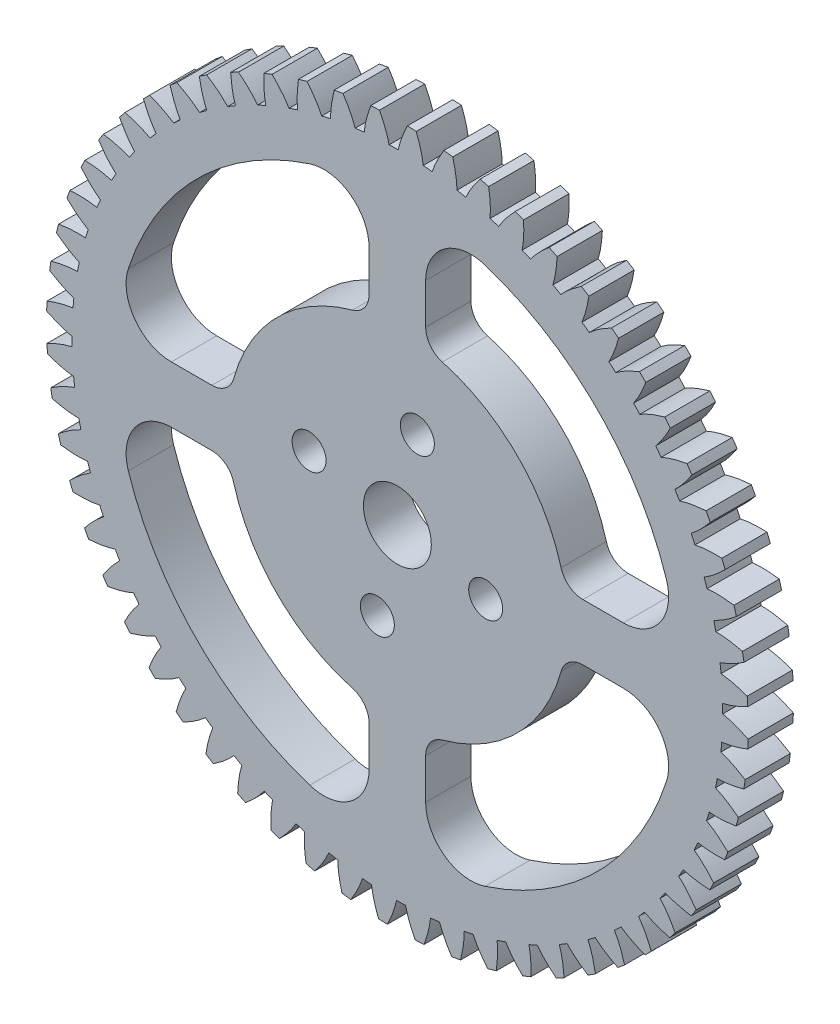
from build123d import *

# Parameters (mm, degrees)
EXTRUDE_1_DEPTH     = 4
SKETCH_7_R          = 3
CUT_EXTRUDE_1_DEPTH = 45.005100553
SKETCH_8_R          = 1.5
CUT_EXTRUDE_2_DEPTH = 45.005100553
CUT_EXTRUDE_3_DEPTH = 45.005100553
FILLET_1_R          = 4
FILLET_2_R          = 2


with BuildPart() as part:
    # 草图6 → 凸台-拉伸1 (new body)
    with BuildSketch(Plane.XY):
        with BuildLine():
            ThreePointArc((3.07982651, 28.584561719), (2.682610889, 28.624571592), (2.284877997, 28.659061962))
            add(Edge.make_bspline(
                [(2.284877997, 28.659061962), (2.278167168, 28.715603398), (2.245299574, 28.963818331), (2.156727862, 29.439082851), (2.003028036, 30.015823083), (1.830054345, 30.526803196), (1.707093128, 30.849984997), (1.665638862, 30.955220031)],
                knots=[0.033215675, 0.033215675, 0.033215675, 0.033215675, 0.033215675, 0.046610139, 0.092110525, 0.146842495, 0.173450652, 0.173450652, 0.173450652, 0.173450652, 0.173450652], degree=4))
            ThreePointArc((1.665638862, 30.955220031), (1.273253712, 30.973840979), (0.880664109, 30.987488293))
            add(Edge.make_bspline(
                [(0.075054588, 28.749902031), (0.086383474, 28.805701901), (0.139512684, 29.05038173), (0.266793411, 29.51677312), (0.467311243, 30.078952389), (0.681640578, 30.574011487), (0.830712428, 30.886010719), (0.880664109, 30.987488293)],
                knots=[0.033215675, 0.033215675, 0.033215675, 0.033215675, 0.033215675, 0.046610139, 0.092110525, 0.146842495, 0.173450652, 0.173450652, 0.173450652, 0.173450652, 0.173450652], degree=4))
            ThreePointArc((0.075054588, 28.749902031), (-0.324167214, 28.748172387), (-0.72332651, 28.740899408))
            add(Edge.make_bspline(
                [(-0.72332651, 28.740899408), (-0.735910765, 28.796429631), (-0.794543833, 29.039849218), (-0.93230901, 29.503251924), (-1.145452622, 30.060766706), (-1.370890711, 30.550866943), (-1.52696003, 30.859425373), (-1.579187262, 30.959750768)],
                knots=[0.033215675, 0.033215675, 0.033215675, 0.033215675, 0.033215675, 0.046610139, 0.092110525, 0.146842495, 0.173450652, 0.173450652, 0.173450652, 0.173450652, 0.173450652], degree=4))
            ThreePointArc((-1.579187262, 30.959750768), (-1.971369304, 30.937254291), (-2.363234793, 30.909790056))
            add(Edge.make_bspline(
                [(-2.930539647, 28.600252401), (-2.925105497, 28.656930784), (-2.89784334, 28.905823746), (-2.820011046, 29.382964654), (-2.679355407, 29.963024067), (-2.517947957, 30.477774695), (-2.402305539, 30.803647014), (-2.363234793, 30.909790056)],
                knots=[0.033215675, 0.033215675, 0.033215675, 0.033215675, 0.033215675, 0.046610139, 0.092110525, 0.146842495, 0.173450652, 0.173450652, 0.173450652, 0.173450652, 0.173450652], degree=4))
            ThreePointArc((-2.930539647, 28.600252401), (-3.327393674, 28.55680219), (-3.723606099, 28.507845545))
            add(Edge.make_bspline(
                [(-3.723606099, 28.507845545), (-3.741925905, 28.561756155), (-3.825682051, 28.797713439), (-4.011131308, 29.244177195), (-4.281383461, 29.776358278), (-4.556816001, 30.240208998), (-4.744283495, 30.530763426), (-4.80671148, 30.625079996)],
                knots=[0.033215675, 0.033215675, 0.033215675, 0.033215675, 0.033215675, 0.046610139, 0.092110525, 0.146842495, 0.173450652, 0.173450652, 0.173450652, 0.173450652, 0.173450652], degree=4))
            ThreePointArc((-4.80671148, 30.625079996), (-5.194393585, 30.561712571), (-5.5812416, 30.493437691))
            add(Edge.make_bspline(
                [(-5.904026277, 28.13725242), (-5.9045464, 28.194188336), (-5.903449987, 28.444567508), (-5.875918872, 28.927230278), (-5.796666478, 29.518814583), (-5.689949328, 30.047617026), (-5.609003343, 30.383792107), (-5.5812416, 30.493437691)],
                knots=[0.033215675, 0.033215675, 0.033215675, 0.033215675, 0.033215675, 0.046610139, 0.092110525, 0.146842495, 0.173450652, 0.173450652, 0.173450652, 0.173450652, 0.173450652], degree=4))
            ThreePointArc((-5.904026277, 28.13725242), (-6.294164512, 28.052557693), (-6.683089082, 27.962453761))
            add(Edge.make_bspline(
                [(-6.683089082, 27.962453761), (-6.706943723, 28.014154102), (-6.814905295, 28.240063886), (-7.046006813, 28.664697141), (-7.370406567, 29.165713838), (-7.692815862, 29.598232995), (-7.909627597, 29.867600047), (-7.981572361, 29.954874439)],
                knots=[0.033215675, 0.033215675, 0.033215675, 0.033215675, 0.033215675, 0.046610139, 0.092110525, 0.146842495, 0.173450652, 0.173450652, 0.173450652, 0.173450652, 0.173450652], degree=4))
            ThreePointArc((-7.981572361, 29.954874439), (-8.360507004, 29.851330333), (-8.738099156, 29.742992841))
            add(Edge.make_bspline(
                [(-8.812827159, 27.365974813), (-8.819295857, 27.422544461), (-8.8443772, 27.671666636), (-8.867448901, 28.154563114), (-8.850468059, 28.751190789), (-8.799610422, 29.288251376), (-8.754247733, 29.631046014), (-8.738099156, 29.742992841)],
                knots=[0.033215675, 0.033215675, 0.033215675, 0.033215675, 0.033215675, 0.046610139, 0.092110525, 0.146842495, 0.173450652, 0.173450652, 0.173450652, 0.173450652, 0.173450652], degree=4))
            ThreePointArc((-8.812827159, 27.365974813), (-9.191975167, 27.240963502), (-9.569350741, 27.110699482))
            add(Edge.make_bspline(
                [(-9.569350741, 27.110699482), (-9.598478861, 27.159623114), (-9.729463012, 27.373010284), (-10.003684793, 27.771160666), (-10.378677956, 28.235523734), (-10.744531622, 28.631972557), (-10.988312164, 28.877200991), (-11.068985465, 28.956477009)],
                knots=[0.033215675, 0.033215675, 0.033215675, 0.033215675, 0.033215675, 0.046610139, 0.092110525, 0.146842495, 0.173450652, 0.173450652, 0.173450652, 0.173450652, 0.173450652], degree=4))
            ThreePointArc((-11.068985465, 28.956477009), (-11.435020958, 28.813890673), (-11.799220269, 28.666677538))
            add(Edge.make_bspline(
                [(-11.625072863, 26.29486986), (-11.637419263, 26.35045345), (-11.688403566, 26.595589193), (-11.761825304, 27.073428665), (-11.807302059, 27.668562932), (-11.812861144, 28.207997516), (-11.803578753, 28.553655981), (-11.799220269, 28.666677538)],
                knots=[0.033215675, 0.033215675, 0.033215675, 0.033215675, 0.033215675, 0.046610139, 0.092110525, 0.146842495, 0.173450652, 0.173450652, 0.173450652, 0.173450652, 0.173450652], degree=4))
            ThreePointArc((-11.625072863, 26.29486986), (-11.989076618, 26.130911616), (-12.350768591, 25.961914706))
            add(Edge.make_bspline(
                [(-12.350768591, 25.961914706), (-12.384851057, 26.007525612), (-12.537422695, 26.206052252), (-12.851760308, 26.573357544), (-13.273238378, 26.995979323), (-13.678528045, 27.352014237), (-13.946606483, 27.570417278), (-14.035124448, 27.640826358)],
                knots=[0.033215675, 0.033215675, 0.033215675, 0.033215675, 0.033215675, 0.046610139, 0.092110525, 0.146842495, 0.173450652, 0.173450652, 0.173450652, 0.173450652, 0.173450652], degree=4))
            ThreePointArc((-14.035124448, 27.640826358), (-14.384250429, 27.460759997), (-14.731066656, 27.276284116))
            add(Edge.make_bspline(
                [(-14.309951836, 24.935672809), (-14.328040668, 24.989661357), (-14.404369336, 25.22812491), (-14.527336688, 25.695672065), (-14.634772787, 26.28279251), (-14.696687687, 26.818690932), (-14.723587294, 27.163426118), (-14.731066656, 27.276284116)],
                knots=[0.033215675, 0.033215675, 0.033215675, 0.033215675, 0.033215675, 0.046610139, 0.092110525, 0.146842495, 0.173450652, 0.173450652, 0.173450652, 0.173450652, 0.173450652], degree=4))
            ThreePointArc((-14.309951836, 24.935672809), (-14.654823236, 24.734563993), (-14.996868836, 24.52868576))
            add(Edge.make_bspline(
                [(-14.996868836, 24.52868576), (-15.035532233, 24.570484216), (-15.208019752, 24.751975228), (-15.559029249, 25.084411156), (-16.022374422, 25.460661314), (-16.462659653, 25.772381524), (-16.752098863, 25.961566304), (-16.84749167, 26.022337029)],
                knots=[0.033215675, 0.033215675, 0.033215675, 0.033215675, 0.033215675, 0.046610139, 0.092110525, 0.146842495, 0.173450652, 0.173450652, 0.173450652, 0.173450652, 0.173450652], degree=4))
            ThreePointArc((-16.84749167, 26.022337029), (-17.175883043, 25.806763487), (-17.501516394, 25.587046018))
            add(Edge.make_bspline(
                [(-16.838047982, 23.30327531), (-16.861681061, 23.355077305), (-16.962517822, 23.584256011), (-17.133683531, 24.036388306), (-17.301901882, 24.609062313), (-17.419494244, 25.135553158), (-17.482281131, 25.475588074), (-17.501516394, 25.587046018)],
                knots=[0.033215675, 0.033215675, 0.033215675, 0.033215675, 0.033215675, 0.046610139, 0.092110525, 0.146842495, 0.173450652, 0.173450652, 0.173450652, 0.173450652, 0.173450652], degree=4))
            ThreePointArc((-16.838047982, 23.30327531), (-17.160008545, 23.067219311), (-17.478660248, 22.826715399))
            add(Edge.make_bspline(
                [(-17.478660248, 22.826715399), (-17.521480971, 22.864243454), (-17.711994562, 23.026710384), (-18.095830208, 23.320634709), (-18.59596598, 23.646390971), (-19.066422916, 23.910381207), (-19.374051743, 24.068274977), (-19.475274248, 24.118741529)],
                knots=[0.033215675, 0.033215675, 0.033215675, 0.033215675, 0.033215675, 0.046610139, 0.092110525, 0.146842495, 0.173450652, 0.173450652, 0.173450652, 0.173450652, 0.173450652], degree=4))
            ThreePointArc((-19.475274248, 24.118741529), (-19.779333088, 23.870022677), (-20.080215856, 23.617470889))
            add(Edge.make_bspline(
                [(-19.18166295, 21.41556225), (-19.210581348, 21.464610138), (-19.334821413, 21.681993068), (-19.552310152, 22.113756846), (-19.779467719, 22.665710079), (-19.951449177, 23.177025004), (-20.049435438, 23.508634156), (-20.080215856, 23.617470889)],
                knots=[0.033215675, 0.033215675, 0.033215675, 0.033215675, 0.033215675, 0.046610139, 0.092110525, 0.146842495, 0.173450652, 0.173450652, 0.173450652, 0.173450652, 0.173450652], degree=4))
            ThreePointArc((-19.18166295, 21.41556225), (-19.477185209, 21.147145347), (-19.768951801, 20.874650768))
            add(Edge.make_bspline(
                [(-19.768951801, 20.874650768), (-19.815460697, 20.907497256), (-20.021913053, 21.049160082), (-20.434369466, 21.301352509), (-20.965816242, 21.57304582), (-21.46129046, 21.78641375), (-21.783738457, 21.911286592), (-21.889681646, 21.950896051)],
                knots=[0.033215675, 0.033215675, 0.033215675, 0.033215675, 0.033215675, 0.046610139, 0.092110525, 0.146842495, 0.173450652, 0.173450652, 0.173450652, 0.173450652, 0.173450652], degree=4))
            ThreePointArc((-21.889681646, 21.950896051), (-22.16607662, 21.671756903), (-22.43891227, 21.389137807))
            add(Edge.make_bspline(
                [(-21.315119606, 19.293215808), (-21.349006486, 19.338972211), (-21.495288654, 19.542177672), (-21.756717572, 19.948842439), (-22.040325568, 20.474027583), (-22.264811857, 20.964564513), (-22.396923935, 21.284114723), (-22.43891227, 21.389137807)],
                knots=[0.033215675, 0.033215675, 0.033215675, 0.033215675, 0.033215675, 0.046610139, 0.092110525, 0.146842495, 0.173450652, 0.173450652, 0.173450652, 0.173450652, 0.173450652], degree=4))
            ThreePointArc((-21.315119606, 19.293215808), (-21.580965756, 18.995378833), (-21.84265058, 18.693879095))
            add(Edge.make_bspline(
                [(-21.84265058, 18.693879095), (-21.892338089, 18.721684143), (-22.112467275, 18.840990778), (-22.549025495, 19.048688233), (-23.105960635, 19.263341865), (-23.621023615, 19.423749784), (-23.954757974, 19.514233566), (-24.064261111, 19.542551962)],
                knots=[0.033215675, 0.033215675, 0.033215675, 0.033215675, 0.033215675, 0.046610139, 0.092110525, 0.146842495, 0.173450652, 0.173450652, 0.173450652, 0.173450652, 0.173450652], degree=4))
            ThreePointArc((-24.064261111, 19.542551962), (-24.309963979, 19.236050825), (-24.551763267, 18.926460855))
            add(Edge.make_bspline(
                [(-23.21504335, 16.959488856), (-23.253527441, 17.001452458), (-23.420249014, 17.188254087), (-23.722753841, 17.565364339), (-24.059704999, 18.058027356), (-24.3342366, 18.522411867), (-24.499027046, 18.826402074), (-24.551763267, 18.926460855)],
                knots=[0.033215675, 0.033215675, 0.033215675, 0.033215675, 0.033215675, 0.046610139, 0.092110525, 0.146842495, 0.173450652, 0.173450652, 0.173450652, 0.173450652, 0.173450652], degree=4))
            ThreePointArc((-23.21504335, 16.959488856), (-23.448300727, 16.635494974), (-23.677036709, 16.308293371))
            add(Edge.make_bspline(
                [(-23.677036709, 16.308293371), (-23.729358443, 16.330752341), (-23.960752678, 16.426395636), (-24.416629682, 16.587322543), (-24.992951287, 16.742584705), (-25.521959892, 16.848275151), (-25.86332415, 16.903378514), (-25.975187496, 16.920095584)],
                knots=[0.033215675, 0.033215675, 0.033215675, 0.033215675, 0.033215675, 0.046610139, 0.092110525, 0.146842495, 0.173450652, 0.173450652, 0.173450652, 0.173450652, 0.173450652], degree=4))
            ThreePointArc((-25.975187496, 16.920095584), (-26.187506284, 16.58959055), (-26.395620007, 16.256421637))
            add(Edge.make_bspline(
                [(-24.860618221, 14.439950196), (-24.903277883, 14.477661233), (-25.088612226, 14.646012394), (-25.428878654, 14.989436432), (-25.815481267, 15.444179602), (-26.137050354, 15.8773238), (-26.332713691, 16.162423425), (-26.395620007, 16.256421637)],
                knots=[0.033215675, 0.033215675, 0.033215675, 0.033215675, 0.033215675, 0.046610139, 0.092110525, 0.146842495, 0.173450652, 0.173450652, 0.173450652, 0.173450652, 0.173450652], degree=4))
            ThreePointArc((-24.860618221, 14.439950196), (-25.058731207, 14.093349151), (-25.252012269, 13.744030571))
            add(Edge.make_bspline(
                [(-25.252012269, 13.744030571), (-25.306394981, 13.760897398), (-25.546519061, 13.831829465), (-26.016720165, 13.944222675), (-26.606113935, 14.038392283), (-27.143272235, 14.08820729), (-27.488526334, 14.10732651), (-27.601524291, 14.112259097)],
                knots=[0.033215675, 0.033215675, 0.033215675, 0.033215675, 0.033215675, 0.046610139, 0.092110525, 0.146842495, 0.173450652, 0.173450652, 0.173450652, 0.173450652, 0.173450652], degree=4))
            ThreePointArc((-27.601524291, 14.112259097), (-27.778132791, 13.761371248), (-27.950280811, 13.408273662))
            add(Edge.make_bspline(
                [(-26.233814957, 11.762204419), (-26.280182802, 11.795249723), (-26.482099351, 11.943305924), (-26.856399352, 12.249281122), (-27.28841772, 12.661122185), (-27.653501115, 13.058280451), (-27.877893613, 13.321365883), (-27.950280811, 13.408273662)],
                knots=[0.033215675, 0.033215675, 0.033215675, 0.033215675, 0.033215675, 0.046610139, 0.092110525, 0.146842495, 0.173450652, 0.173450652, 0.173450652, 0.173450652, 0.173450652], degree=4))
            ThreePointArc((-26.233814957, 11.762204419), (-26.394612985, 11.396793645), (-26.550321499, 11.029185297))
            add(Edge.make_bspline(
                [(-26.550321499, 11.029185297), (-26.60616936, 11.040275184), (-26.852392435, 11.085718877), (-27.331766018, 11.148346986), (-27.927774432, 11.180392298), (-28.467197208, 11.173786081), (-28.812558472, 11.156711684), (-28.925453009, 11.149805748)],
                knots=[0.033215675, 0.033215675, 0.033215675, 0.033215675, 0.033215675, 0.046610139, 0.092110525, 0.146842495, 0.173450652, 0.173450652, 0.173450652, 0.173450652, 0.173450652], degree=4))
            ThreePointArc((-28.925453009, 11.149805748), (-29.064416262, 10.782379483), (-29.198712489, 10.413221835))
            add(Edge.make_bspline(
                [(-27.319588527, 8.955589469), (-27.369156538, 8.983606988), (-27.585443055, 9.109746095), (-27.989675718, 9.374920126), (-28.462376557, 9.739346864), (-28.866974331, 10.096167849), (-29.117637499, 10.334356668), (-29.198712489, 10.413221835)],
                knots=[0.033215675, 0.033215675, 0.033215675, 0.033215675, 0.033215675, 0.046610139, 0.092110525, 0.146842495, 0.173450652, 0.173450652, 0.173450652, 0.173450652, 0.173450652], degree=4))
            ThreePointArc((-27.319588527, 8.955589469), (-27.441309859, 8.575372483), (-27.55773985, 8.19350196))
            add(Edge.make_bspline(
                [(-27.55773985, 8.19350196), (-27.614440979, 8.198693405), (-27.864065378, 8.218150833), (-28.347359322, 8.230327675), (-28.943452387, 8.199897596), (-29.479229611, 8.136942534), (-29.820914189, 8.08386159), (-29.932468412, 8.065192793)],
                knots=[0.033215675, 0.033215675, 0.033215675, 0.033215675, 0.033215675, 0.046610139, 0.092110525, 0.146842495, 0.173450652, 0.173450652, 0.173450652, 0.173450652, 0.173450652], degree=4))
            ThreePointArc((-29.932468412, 8.065192793), (-30.032263907, 7.685253713), (-30.127236963, 7.304080571))
            add(Edge.make_bspline(
                [(-28.106042967, 6.050855207), (-28.158268068, 6.073537975), (-28.386554872, 6.176377982), (-28.81629134, 6.397845542), (-29.324495641, 6.71086522), (-29.764174936, 7.023439519), (-30.038362456, 7.234122079), (-30.127236963, 7.304080571)],
                knots=[0.033215675, 0.033215675, 0.033215675, 0.033215675, 0.033215675, 0.046610139, 0.092110525, 0.146842495, 0.173450652, 0.173450652, 0.173450652, 0.173450652, 0.173450652], degree=4))
            ThreePointArc((-28.106042967, 6.050855207), (-28.187354, 5.659997746), (-28.263229836, 5.268048901))
            add(Edge.make_bspline(
                [(-28.263229836, 5.268048901), (-28.320163004, 5.267285025), (-28.570453789, 5.260543008), (-29.052373026, 5.222135171), (-29.642019821, 5.129563099), (-30.168281406, 5.010948942), (-30.50254573, 4.922443017), (-30.611537426, 4.892215898)],
                knots=[0.033215675, 0.033215675, 0.033215675, 0.033215675, 0.033215675, 0.046610139, 0.092110525, 0.146842495, 0.173450652, 0.173450652, 0.173450652, 0.173450652, 0.173450652], degree=4))
            ThreePointArc((-30.611537426, 4.892215898), (-30.671071783, 4.503926694), (-30.725681124, 4.114914271))
            add(Edge.make_bspline(
                [(-28.584561719, 3.07982651), (-28.63887172, 3.096926009), (-28.876657653, 3.175340179), (-29.327189643, 3.350674824), (-29.865329415, 3.608857933), (-30.335273011, 3.873760916), (-30.629980827, 4.054628935), (-30.725681124, 4.114914271)],
                knots=[0.033215675, 0.033215675, 0.033215675, 0.033215675, 0.033215675, 0.046610139, 0.092110525, 0.146842495, 0.173450652, 0.173450652, 0.173450652, 0.173450652, 0.173450652], degree=4))
            ThreePointArc((-28.584561719, 3.07982651), (-28.624571592, 2.682610889), (-28.659061962, 2.284877997))
            add(Edge.make_bspline(
                [(-28.659061962, 2.284877997), (-28.715603398, 2.278167168), (-28.963818331, 2.245299574), (-29.439082851, 2.156727862), (-30.015823083, 2.003028036), (-30.526803196, 1.830054345), (-30.849984997, 1.707093128), (-30.955220031, 1.665638862)],
                knots=[0.033215675, 0.033215675, 0.033215675, 0.033215675, 0.033215675, 0.046610139, 0.092110525, 0.146842495, 0.173450652, 0.173450652, 0.173450652, 0.173450652, 0.173450652], degree=4))
            ThreePointArc((-30.955220031, 1.665638862), (-30.973840979, 1.273253712), (-30.987488293, 0.880664109))
            add(Edge.make_bspline(
                [(-28.749902031, 0.075054588), (-28.805701901, 0.086383474), (-29.05038173, 0.139512684), (-29.51677312, 0.266793411), (-30.078952389, 0.467311243), (-30.574011487, 0.681640578), (-30.886010719, 0.830712428), (-30.987488293, 0.880664109)],
                knots=[0.033215675, 0.033215675, 0.033215675, 0.033215675, 0.033215675, 0.046610139, 0.092110525, 0.146842495, 0.173450652, 0.173450652, 0.173450652, 0.173450652, 0.173450652], degree=4))
            ThreePointArc((-28.749902031, 0.075054588), (-28.748172387, -0.324167214), (-28.740899408, -0.72332651))
            add(Edge.make_bspline(
                [(-28.740899408, -0.72332651), (-28.796429631, -0.735910765), (-29.039849218, -0.794543833), (-29.503251924, -0.93230901), (-30.060766706, -1.145452622), (-30.550866943, -1.370890711), (-30.859425373, -1.52696003), (-30.959750768, -1.579187262)],
                knots=[0.033215675, 0.033215675, 0.033215675, 0.033215675, 0.033215675, 0.046610139, 0.092110525, 0.146842495, 0.173450652, 0.173450652, 0.173450652, 0.173450652, 0.173450652], degree=4))
            ThreePointArc((-30.959750768, -1.579187262), (-30.937254291, -1.971369304), (-30.909790056, -2.363234793))
            add(Edge.make_bspline(
                [(-28.600252401, -2.930539647), (-28.656930784, -2.925105497), (-28.905823746, -2.89784334), (-29.382964654, -2.820011046), (-29.963024067, -2.679355407), (-30.477774695, -2.517947957), (-30.803647014, -2.402305539), (-30.909790056, -2.363234793)],
                knots=[0.033215675, 0.033215675, 0.033215675, 0.033215675, 0.033215675, 0.046610139, 0.092110525, 0.146842495, 0.173450652, 0.173450652, 0.173450652, 0.173450652, 0.173450652], degree=4))
            ThreePointArc((-28.600252401, -2.930539647), (-28.55680219, -3.327393674), (-28.507845545, -3.723606099))
            add(Edge.make_bspline(
                [(-28.507845545, -3.723606099), (-28.561756155, -3.741925905), (-28.797713439, -3.825682051), (-29.244177195, -4.011131308), (-29.776358278, -4.281383461), (-30.240208998, -4.556816001), (-30.530763426, -4.744283495), (-30.625079996, -4.80671148)],
                knots=[0.033215675, 0.033215675, 0.033215675, 0.033215675, 0.033215675, 0.046610139, 0.092110525, 0.146842495, 0.173450652, 0.173450652, 0.173450652, 0.173450652, 0.173450652], degree=4))
            ThreePointArc((-30.625079996, -4.80671148), (-30.561712571, -5.194393585), (-30.493437691, -5.5812416))
            add(Edge.make_bspline(
                [(-28.13725242, -5.904026277), (-28.194188336, -5.9045464), (-28.444567508, -5.903449987), (-28.927230278, -5.875918872), (-29.518814583, -5.796666478), (-30.047617026, -5.689949328), (-30.383792107, -5.609003343), (-30.493437691, -5.5812416)],
                knots=[0.033215675, 0.033215675, 0.033215675, 0.033215675, 0.033215675, 0.046610139, 0.092110525, 0.146842495, 0.173450652, 0.173450652, 0.173450652, 0.173450652, 0.173450652], degree=4))
            ThreePointArc((-28.13725242, -5.904026277), (-28.052557693, -6.294164512), (-27.962453761, -6.683089082))
            add(Edge.make_bspline(
                [(-27.962453761, -6.683089082), (-28.014154102, -6.706943723), (-28.240063886, -6.814905295), (-28.664697141, -7.046006813), (-29.165713838, -7.370406567), (-29.598232995, -7.692815862), (-29.867600047, -7.909627597), (-29.954874439, -7.981572361)],
                knots=[0.033215675, 0.033215675, 0.033215675, 0.033215675, 0.033215675, 0.046610139, 0.092110525, 0.146842495, 0.173450652, 0.173450652, 0.173450652, 0.173450652, 0.173450652], degree=4))
            ThreePointArc((-29.954874439, -7.981572361), (-29.851330333, -8.360507004), (-29.742992841, -8.738099156))
            add(Edge.make_bspline(
                [(-27.365974813, -8.812827159), (-27.422544461, -8.819295857), (-27.671666636, -8.8443772), (-28.154563114, -8.867448901), (-28.751190789, -8.850468059), (-29.288251376, -8.799610422), (-29.631046014, -8.754247733), (-29.742992841, -8.738099156)],
                knots=[0.033215675, 0.033215675, 0.033215675, 0.033215675, 0.033215675, 0.046610139, 0.092110525, 0.146842495, 0.173450652, 0.173450652, 0.173450652, 0.173450652, 0.173450652], degree=4))
            ThreePointArc((-27.365974813, -8.812827159), (-27.240963502, -9.191975167), (-27.110699482, -9.569350741))
            add(Edge.make_bspline(
                [(-27.110699482, -9.569350741), (-27.159623114, -9.598478861), (-27.373010284, -9.729463012), (-27.771160666, -10.003684793), (-28.235523734, -10.378677956), (-28.631972557, -10.744531622), (-28.877200991, -10.988312164), (-28.956477009, -11.068985465)],
                knots=[0.033215675, 0.033215675, 0.033215675, 0.033215675, 0.033215675, 0.046610139, 0.092110525, 0.146842495, 0.173450652, 0.173450652, 0.173450652, 0.173450652, 0.173450652], degree=4))
            ThreePointArc((-28.956477009, -11.068985465), (-28.813890673, -11.435020958), (-28.666677538, -11.799220269))
            add(Edge.make_bspline(
                [(-26.29486986, -11.625072863), (-26.35045345, -11.637419263), (-26.595589193, -11.688403566), (-27.073428665, -11.761825304), (-27.668562932, -11.807302059), (-28.207997516, -11.812861144), (-28.553655981, -11.803578753), (-28.666677538, -11.799220269)],
                knots=[0.033215675, 0.033215675, 0.033215675, 0.033215675, 0.033215675, 0.046610139, 0.092110525, 0.146842495, 0.173450652, 0.173450652, 0.173450652, 0.173450652, 0.173450652], degree=4))
            ThreePointArc((-26.29486986, -11.625072863), (-26.130911616, -11.989076618), (-25.961914706, -12.350768591))
            add(Edge.make_bspline(
                [(-25.961914706, -12.350768591), (-26.007525612, -12.384851057), (-26.206052252, -12.537422695), (-26.573357544, -12.851760308), (-26.995979323, -13.273238378), (-27.352014237, -13.678528045), (-27.570417278, -13.946606483), (-27.640826358, -14.035124448)],
                knots=[0.033215675, 0.033215675, 0.033215675, 0.033215675, 0.033215675, 0.046610139, 0.092110525, 0.146842495, 0.173450652, 0.173450652, 0.173450652, 0.173450652, 0.173450652], degree=4))
            ThreePointArc((-27.640826358, -14.035124448), (-27.460759997, -14.384250429), (-27.276284116, -14.731066656))
            add(Edge.make_bspline(
                [(-24.935672809, -14.309951836), (-24.989661357, -14.328040668), (-25.22812491, -14.404369336), (-25.695672065, -14.527336688), (-26.28279251, -14.634772787), (-26.818690932, -14.696687687), (-27.163426118, -14.723587294), (-27.276284116, -14.731066656)],
                knots=[0.033215675, 0.033215675, 0.033215675, 0.033215675, 0.033215675, 0.046610139, 0.092110525, 0.146842495, 0.173450652, 0.173450652, 0.173450652, 0.173450652, 0.173450652], degree=4))
            ThreePointArc((-24.935672809, -14.309951836), (-24.734563993, -14.654823236), (-24.52868576, -14.996868836))
            add(Edge.make_bspline(
                [(-24.52868576, -14.996868836), (-24.570484216, -15.035532233), (-24.751975228, -15.208019752), (-25.084411156, -15.559029249), (-25.460661314, -16.022374422), (-25.772381524, -16.462659653), (-25.961566304, -16.752098863), (-26.022337029, -16.84749167)],
                knots=[0.033215675, 0.033215675, 0.033215675, 0.033215675, 0.033215675, 0.046610139, 0.092110525, 0.146842495, 0.173450652, 0.173450652, 0.173450652, 0.173450652, 0.173450652], degree=4))
            ThreePointArc((-26.022337029, -16.84749167), (-25.806763487, -17.175883043), (-25.587046018, -17.501516394))
            add(Edge.make_bspline(
                [(-23.30327531, -16.838047982), (-23.355077305, -16.861681061), (-23.584256011, -16.962517822), (-24.036388306, -17.133683531), (-24.609062313, -17.301901882), (-25.135553158, -17.419494244), (-25.475588074, -17.482281131), (-25.587046018, -17.501516394)],
                knots=[0.033215675, 0.033215675, 0.033215675, 0.033215675, 0.033215675, 0.046610139, 0.092110525, 0.146842495, 0.173450652, 0.173450652, 0.173450652, 0.173450652, 0.173450652], degree=4))
            ThreePointArc((-23.30327531, -16.838047982), (-23.067219311, -17.160008545), (-22.826715399, -17.478660248))
            add(Edge.make_bspline(
                [(-22.826715399, -17.478660248), (-22.864243454, -17.521480971), (-23.026710384, -17.711994562), (-23.320634709, -18.095830208), (-23.646390971, -18.59596598), (-23.910381207, -19.066422916), (-24.068274977, -19.374051743), (-24.118741529, -19.475274248)],
                knots=[0.033215675, 0.033215675, 0.033215675, 0.033215675, 0.033215675, 0.046610139, 0.092110525, 0.146842495, 0.173450652, 0.173450652, 0.173450652, 0.173450652, 0.173450652], degree=4))
            ThreePointArc((-24.118741529, -19.475274248), (-23.870022677, -19.779333088), (-23.617470889, -20.080215856))
            add(Edge.make_bspline(
                [(-21.41556225, -19.18166295), (-21.464610138, -19.210581348), (-21.681993068, -19.334821413), (-22.113756846, -19.552310152), (-22.665710079, -19.779467719), (-23.177025004, -19.951449177), (-23.508634156, -20.049435438), (-23.617470889, -20.080215856)],
                knots=[0.033215675, 0.033215675, 0.033215675, 0.033215675, 0.033215675, 0.046610139, 0.092110525, 0.146842495, 0.173450652, 0.173450652, 0.173450652, 0.173450652, 0.173450652], degree=4))
            ThreePointArc((-21.41556225, -19.18166295), (-21.147145347, -19.477185209), (-20.874650768, -19.768951801))
            add(Edge.make_bspline(
                [(-20.874650768, -19.768951801), (-20.907497256, -19.815460697), (-21.049160082, -20.021913053), (-21.301352509, -20.434369466), (-21.57304582, -20.965816242), (-21.78641375, -21.46129046), (-21.911286592, -21.783738457), (-21.950896051, -21.889681646)],
                knots=[0.033215675, 0.033215675, 0.033215675, 0.033215675, 0.033215675, 0.046610139, 0.092110525, 0.146842495, 0.173450652, 0.173450652, 0.173450652, 0.173450652, 0.173450652], degree=4))
            ThreePointArc((-21.950896051, -21.889681646), (-21.671756903, -22.16607662), (-21.389137807, -22.43891227))
            add(Edge.make_bspline(
                [(-19.293215808, -21.315119606), (-19.338972211, -21.349006486), (-19.542177672, -21.495288654), (-19.948842439, -21.756717572), (-20.474027583, -22.040325568), (-20.964564513, -22.264811857), (-21.284114723, -22.396923935), (-21.389137807, -22.43891227)],
                knots=[0.033215675, 0.033215675, 0.033215675, 0.033215675, 0.033215675, 0.046610139, 0.092110525, 0.146842495, 0.173450652, 0.173450652, 0.173450652, 0.173450652, 0.173450652], degree=4))
            ThreePointArc((-19.293215808, -21.315119606), (-18.995378833, -21.580965756), (-18.693879095, -21.84265058))
            add(Edge.make_bspline(
                [(-18.693879095, -21.84265058), (-18.721684143, -21.892338089), (-18.840990778, -22.112467275), (-19.048688233, -22.549025495), (-19.263341865, -23.105960635), (-19.423749784, -23.621023615), (-19.514233566, -23.954757974), (-19.542551962, -24.064261111)],
                knots=[0.033215675, 0.033215675, 0.033215675, 0.033215675, 0.033215675, 0.046610139, 0.092110525, 0.146842495, 0.173450652, 0.173450652, 0.173450652, 0.173450652, 0.173450652], degree=4))
            ThreePointArc((-19.542551962, -24.064261111), (-19.236050825, -24.309963979), (-18.926460855, -24.551763267))
            add(Edge.make_bspline(
                [(-16.959488856, -23.21504335), (-17.001452458, -23.253527441), (-17.188254087, -23.420249014), (-17.565364339, -23.722753841), (-18.058027356, -24.059704999), (-18.522411867, -24.3342366), (-18.826402074, -24.499027046), (-18.926460855, -24.551763267)],
                knots=[0.033215675, 0.033215675, 0.033215675, 0.033215675, 0.033215675, 0.046610139, 0.092110525, 0.146842495, 0.173450652, 0.173450652, 0.173450652, 0.173450652, 0.173450652], degree=4))
            ThreePointArc((-16.959488856, -23.21504335), (-16.635494974, -23.448300727), (-16.308293371, -23.677036709))
            add(Edge.make_bspline(
                [(-16.308293371, -23.677036709), (-16.330752341, -23.729358443), (-16.426395636, -23.960752678), (-16.587322543, -24.416629682), (-16.742584705, -24.992951287), (-16.848275151, -25.521959892), (-16.903378514, -25.86332415), (-16.920095584, -25.975187496)],
                knots=[0.033215675, 0.033215675, 0.033215675, 0.033215675, 0.033215675, 0.046610139, 0.092110525, 0.146842495, 0.173450652, 0.173450652, 0.173450652, 0.173450652, 0.173450652], degree=4))
            ThreePointArc((-16.920095584, -25.975187496), (-16.58959055, -26.187506284), (-16.256421637, -26.395620007))
            add(Edge.make_bspline(
                [(-14.439950196, -24.860618221), (-14.477661233, -24.903277883), (-14.646012394, -25.088612226), (-14.989436432, -25.428878654), (-15.444179602, -25.815481267), (-15.8773238, -26.137050354), (-16.162423425, -26.332713691), (-16.256421637, -26.395620007)],
                knots=[0.033215675, 0.033215675, 0.033215675, 0.033215675, 0.033215675, 0.046610139, 0.092110525, 0.146842495, 0.173450652, 0.173450652, 0.173450652, 0.173450652, 0.173450652], degree=4))
            ThreePointArc((-14.439950196, -24.860618221), (-14.093349151, -25.058731207), (-13.744030571, -25.252012269))
            add(Edge.make_bspline(
                [(-13.744030571, -25.252012269), (-13.760897398, -25.306394981), (-13.831829465, -25.546519061), (-13.944222675, -26.016720165), (-14.038392283, -26.606113935), (-14.08820729, -27.143272235), (-14.10732651, -27.488526334), (-14.112259097, -27.601524291)],
                knots=[0.033215675, 0.033215675, 0.033215675, 0.033215675, 0.033215675, 0.046610139, 0.092110525, 0.146842495, 0.173450652, 0.173450652, 0.173450652, 0.173450652, 0.173450652], degree=4))
            ThreePointArc((-14.112259097, -27.601524291), (-13.761371248, -27.778132791), (-13.408273662, -27.950280811))
            add(Edge.make_bspline(
                [(-11.762204419, -26.233814957), (-11.795249723, -26.280182802), (-11.943305924, -26.482099351), (-12.249281122, -26.856399352), (-12.661122185, -27.28841772), (-13.058280451, -27.653501115), (-13.321365883, -27.877893613), (-13.408273662, -27.950280811)],
                knots=[0.033215675, 0.033215675, 0.033215675, 0.033215675, 0.033215675, 0.046610139, 0.092110525, 0.146842495, 0.173450652, 0.173450652, 0.173450652, 0.173450652, 0.173450652], degree=4))
            ThreePointArc((-11.762204419, -26.233814957), (-11.396793645, -26.394612985), (-11.029185297, -26.550321499))
            add(Edge.make_bspline(
                [(-11.029185297, -26.550321499), (-11.040275184, -26.60616936), (-11.085718877, -26.852392435), (-11.148346986, -27.331766018), (-11.180392298, -27.927774432), (-11.173786081, -28.467197208), (-11.156711684, -28.812558472), (-11.149805748, -28.925453009)],
                knots=[0.033215675, 0.033215675, 0.033215675, 0.033215675, 0.033215675, 0.046610139, 0.092110525, 0.146842495, 0.173450652, 0.173450652, 0.173450652, 0.173450652, 0.173450652], degree=4))
            ThreePointArc((-11.149805748, -28.925453009), (-10.782379483, -29.064416262), (-10.413221835, -29.198712489))
            add(Edge.make_bspline(
                [(-8.955589469, -27.319588527), (-8.983606988, -27.369156538), (-9.109746095, -27.585443055), (-9.374920126, -27.989675718), (-9.739346864, -28.462376557), (-10.096167849, -28.866974331), (-10.334356668, -29.117637499), (-10.413221835, -29.198712489)],
                knots=[0.033215675, 0.033215675, 0.033215675, 0.033215675, 0.033215675, 0.046610139, 0.092110525, 0.146842495, 0.173450652, 0.173450652, 0.173450652, 0.173450652, 0.173450652], degree=4))
            ThreePointArc((-8.955589469, -27.319588527), (-8.575372483, -27.441309859), (-8.19350196, -27.55773985))
            add(Edge.make_bspline(
                [(-8.19350196, -27.55773985), (-8.198693405, -27.614440979), (-8.218150833, -27.864065378), (-8.230327675, -28.347359322), (-8.199897596, -28.943452387), (-8.136942534, -29.479229611), (-8.08386159, -29.820914189), (-8.065192793, -29.932468412)],
                knots=[0.033215675, 0.033215675, 0.033215675, 0.033215675, 0.033215675, 0.046610139, 0.092110525, 0.146842495, 0.173450652, 0.173450652, 0.173450652, 0.173450652, 0.173450652], degree=4))
            ThreePointArc((-8.065192793, -29.932468412), (-7.685253713, -30.032263907), (-7.304080571, -30.127236963))
            add(Edge.make_bspline(
                [(-6.050855207, -28.106042967), (-6.073537975, -28.158268068), (-6.176377982, -28.386554872), (-6.397845542, -28.81629134), (-6.71086522, -29.324495641), (-7.023439519, -29.764174936), (-7.234122079, -30.038362456), (-7.304080571, -30.127236963)],
                knots=[0.033215675, 0.033215675, 0.033215675, 0.033215675, 0.033215675, 0.046610139, 0.092110525, 0.146842495, 0.173450652, 0.173450652, 0.173450652, 0.173450652, 0.173450652], degree=4))
            ThreePointArc((-6.050855207, -28.106042967), (-5.659997746, -28.187354), (-5.268048901, -28.263229836))
            add(Edge.make_bspline(
                [(-5.268048901, -28.263229836), (-5.267285025, -28.320163004), (-5.260543008, -28.570453789), (-5.222135171, -29.052373026), (-5.129563099, -29.642019821), (-5.010948942, -30.168281406), (-4.922443017, -30.50254573), (-4.892215898, -30.611537426)],
                knots=[0.033215675, 0.033215675, 0.033215675, 0.033215675, 0.033215675, 0.046610139, 0.092110525, 0.146842495, 0.173450652, 0.173450652, 0.173450652, 0.173450652, 0.173450652], degree=4))
            ThreePointArc((-4.892215898, -30.611537426), (-4.503926694, -30.671071783), (-4.114914271, -30.725681124))
            add(Edge.make_bspline(
                [(-3.07982651, -28.584561719), (-3.096926009, -28.63887172), (-3.175340179, -28.876657653), (-3.350674824, -29.327189643), (-3.608857933, -29.865329415), (-3.873760916, -30.335273011), (-4.054628935, -30.629980827), (-4.114914271, -30.725681124)],
                knots=[0.033215675, 0.033215675, 0.033215675, 0.033215675, 0.033215675, 0.046610139, 0.092110525, 0.146842495, 0.173450652, 0.173450652, 0.173450652, 0.173450652, 0.173450652], degree=4))
            ThreePointArc((-3.07982651, -28.584561719), (-2.682610889, -28.624571592), (-2.284877997, -28.659061962))
            add(Edge.make_bspline(
                [(-2.284877997, -28.659061962), (-2.278167168, -28.715603398), (-2.245299574, -28.963818331), (-2.156727862, -29.439082851), (-2.003028036, -30.015823083), (-1.830054345, -30.526803196), (-1.707093128, -30.849984997), (-1.665638862, -30.955220031)],
                knots=[0.033215675, 0.033215675, 0.033215675, 0.033215675, 0.033215675, 0.046610139, 0.092110525, 0.146842495, 0.173450652, 0.173450652, 0.173450652, 0.173450652, 0.173450652], degree=4))
            ThreePointArc((-1.665638862, -30.955220031), (-1.273253712, -30.973840979), (-0.880664109, -30.987488293))
            add(Edge.make_bspline(
                [(-0.075054588, -28.749902031), (-0.086383474, -28.805701901), (-0.139512684, -29.05038173), (-0.266793411, -29.51677312), (-0.467311243, -30.078952389), (-0.681640578, -30.574011487), (-0.830712428, -30.886010719), (-0.880664109, -30.987488293)],
                knots=[0.033215675, 0.033215675, 0.033215675, 0.033215675, 0.033215675, 0.046610139, 0.092110525, 0.146842495, 0.173450652, 0.173450652, 0.173450652, 0.173450652, 0.173450652], degree=4))
            ThreePointArc((-0.075054588, -28.749902031), (0.324167214, -28.748172387), (0.72332651, -28.740899408))
            add(Edge.make_bspline(
                [(0.72332651, -28.740899408), (0.735910765, -28.796429631), (0.794543833, -29.039849218), (0.93230901, -29.503251924), (1.145452622, -30.060766706), (1.370890711, -30.550866943), (1.52696003, -30.859425373), (1.579187262, -30.959750768)],
                knots=[0.033215675, 0.033215675, 0.033215675, 0.033215675, 0.033215675, 0.046610139, 0.092110525, 0.146842495, 0.173450652, 0.173450652, 0.173450652, 0.173450652, 0.173450652], degree=4))
            ThreePointArc((1.579187262, -30.959750768), (1.971369304, -30.937254291), (2.363234793, -30.909790056))
            add(Edge.make_bspline(
                [(2.930539647, -28.600252401), (2.925105497, -28.656930784), (2.89784334, -28.905823746), (2.820011046, -29.382964654), (2.679355407, -29.963024067), (2.517947957, -30.477774695), (2.402305539, -30.803647014), (2.363234793, -30.909790056)],
                knots=[0.033215675, 0.033215675, 0.033215675, 0.033215675, 0.033215675, 0.046610139, 0.092110525, 0.146842495, 0.173450652, 0.173450652, 0.173450652, 0.173450652, 0.173450652], degree=4))
            ThreePointArc((2.930539647, -28.600252401), (3.327393674, -28.55680219), (3.723606099, -28.507845545))
            add(Edge.make_bspline(
                [(3.723606099, -28.507845545), (3.741925905, -28.561756155), (3.825682051, -28.797713439), (4.011131308, -29.244177195), (4.281383461, -29.776358278), (4.556816001, -30.240208998), (4.744283495, -30.530763426), (4.80671148, -30.625079996)],
                knots=[0.033215675, 0.033215675, 0.033215675, 0.033215675, 0.033215675, 0.046610139, 0.092110525, 0.146842495, 0.173450652, 0.173450652, 0.173450652, 0.173450652, 0.173450652], degree=4))
            ThreePointArc((4.80671148, -30.625079996), (5.194393585, -30.561712571), (5.5812416, -30.493437691))
            add(Edge.make_bspline(
                [(5.904026277, -28.13725242), (5.9045464, -28.194188336), (5.903449987, -28.444567508), (5.875918872, -28.927230278), (5.796666478, -29.518814583), (5.689949328, -30.047617026), (5.609003343, -30.383792107), (5.5812416, -30.493437691)],
                knots=[0.033215675, 0.033215675, 0.033215675, 0.033215675, 0.033215675, 0.046610139, 0.092110525, 0.146842495, 0.173450652, 0.173450652, 0.173450652, 0.173450652, 0.173450652], degree=4))
            ThreePointArc((5.904026277, -28.13725242), (6.294164512, -28.052557693), (6.683089082, -27.962453761))
            add(Edge.make_bspline(
                [(6.683089082, -27.962453761), (6.706943723, -28.014154102), (6.814905295, -28.240063886), (7.046006813, -28.664697141), (7.370406567, -29.165713838), (7.692815862, -29.598232995), (7.909627597, -29.867600047), (7.981572361, -29.954874439)],
                knots=[0.033215675, 0.033215675, 0.033215675, 0.033215675, 0.033215675, 0.046610139, 0.092110525, 0.146842495, 0.173450652, 0.173450652, 0.173450652, 0.173450652, 0.173450652], degree=4))
            ThreePointArc((7.981572361, -29.954874439), (8.360507004, -29.851330333), (8.738099156, -29.742992841))
            add(Edge.make_bspline(
                [(8.812827159, -27.365974813), (8.819295857, -27.422544461), (8.8443772, -27.671666636), (8.867448901, -28.154563114), (8.850468059, -28.751190789), (8.799610422, -29.288251376), (8.754247733, -29.631046014), (8.738099156, -29.742992841)],
                knots=[0.033215675, 0.033215675, 0.033215675, 0.033215675, 0.033215675, 0.046610139, 0.092110525, 0.146842495, 0.173450652, 0.173450652, 0.173450652, 0.173450652, 0.173450652], degree=4))
            ThreePointArc((8.812827159, -27.365974813), (9.191975167, -27.240963502), (9.569350741, -27.110699482))
            add(Edge.make_bspline(
                [(9.569350741, -27.110699482), (9.598478861, -27.159623114), (9.729463012, -27.373010284), (10.003684793, -27.771160666), (10.378677956, -28.235523734), (10.744531622, -28.631972557), (10.988312164, -28.877200991), (11.068985465, -28.956477009)],
                knots=[0.033215675, 0.033215675, 0.033215675, 0.033215675, 0.033215675, 0.046610139, 0.092110525, 0.146842495, 0.173450652, 0.173450652, 0.173450652, 0.173450652, 0.173450652], degree=4))
            ThreePointArc((11.068985465, -28.956477009), (11.435020958, -28.813890673), (11.799220269, -28.666677538))
            add(Edge.make_bspline(
                [(11.625072863, -26.29486986), (11.637419263, -26.35045345), (11.688403566, -26.595589193), (11.761825304, -27.073428665), (11.807302059, -27.668562932), (11.812861144, -28.207997516), (11.803578753, -28.553655981), (11.799220269, -28.666677538)],
                knots=[0.033215675, 0.033215675, 0.033215675, 0.033215675, 0.033215675, 0.046610139, 0.092110525, 0.146842495, 0.173450652, 0.173450652, 0.173450652, 0.173450652, 0.173450652], degree=4))
            ThreePointArc((11.625072863, -26.29486986), (11.989076618, -26.130911616), (12.350768591, -25.961914706))
            add(Edge.make_bspline(
                [(12.350768591, -25.961914706), (12.384851057, -26.007525612), (12.537422695, -26.206052252), (12.851760308, -26.573357544), (13.273238378, -26.995979323), (13.678528045, -27.352014237), (13.946606483, -27.570417278), (14.035124448, -27.640826358)],
                knots=[0.033215675, 0.033215675, 0.033215675, 0.033215675, 0.033215675, 0.046610139, 0.092110525, 0.146842495, 0.173450652, 0.173450652, 0.173450652, 0.173450652, 0.173450652], degree=4))
            ThreePointArc((14.035124448, -27.640826358), (14.384250429, -27.460759997), (14.731066656, -27.276284116))
            add(Edge.make_bspline(
                [(14.309951836, -24.935672809), (14.328040668, -24.989661357), (14.404369336, -25.22812491), (14.527336688, -25.695672065), (14.634772787, -26.28279251), (14.696687687, -26.818690932), (14.723587294, -27.163426118), (14.731066656, -27.276284116)],
                knots=[0.033215675, 0.033215675, 0.033215675, 0.033215675, 0.033215675, 0.046610139, 0.092110525, 0.146842495, 0.173450652, 0.173450652, 0.173450652, 0.173450652, 0.173450652], degree=4))
            ThreePointArc((14.309951836, -24.935672809), (14.654823236, -24.734563993), (14.996868836, -24.52868576))
            add(Edge.make_bspline(
                [(14.996868836, -24.52868576), (15.035532233, -24.570484216), (15.208019752, -24.751975228), (15.559029249, -25.084411156), (16.022374422, -25.460661314), (16.462659653, -25.772381524), (16.752098863, -25.961566304), (16.84749167, -26.022337029)],
                knots=[0.033215675, 0.033215675, 0.033215675, 0.033215675, 0.033215675, 0.046610139, 0.092110525, 0.146842495, 0.173450652, 0.173450652, 0.173450652, 0.173450652, 0.173450652], degree=4))
            ThreePointArc((16.84749167, -26.022337029), (17.175883043, -25.806763487), (17.501516394, -25.587046018))
            add(Edge.make_bspline(
                [(16.838047982, -23.30327531), (16.861681061, -23.355077305), (16.962517822, -23.584256011), (17.133683531, -24.036388306), (17.301901882, -24.609062313), (17.419494244, -25.135553158), (17.482281131, -25.475588074), (17.501516394, -25.587046018)],
                knots=[0.033215675, 0.033215675, 0.033215675, 0.033215675, 0.033215675, 0.046610139, 0.092110525, 0.146842495, 0.173450652, 0.173450652, 0.173450652, 0.173450652, 0.173450652], degree=4))
            ThreePointArc((16.838047982, -23.30327531), (17.160008545, -23.067219311), (17.478660248, -22.826715399))
            add(Edge.make_bspline(
                [(17.478660248, -22.826715399), (17.521480971, -22.864243454), (17.711994562, -23.026710384), (18.095830208, -23.320634709), (18.59596598, -23.646390971), (19.066422916, -23.910381207), (19.374051743, -24.068274977), (19.475274248, -24.118741529)],
                knots=[0.033215675, 0.033215675, 0.033215675, 0.033215675, 0.033215675, 0.046610139, 0.092110525, 0.146842495, 0.173450652, 0.173450652, 0.173450652, 0.173450652, 0.173450652], degree=4))
            ThreePointArc((19.475274248, -24.118741529), (19.779333088, -23.870022677), (20.080215856, -23.617470889))
            add(Edge.make_bspline(
                [(19.18166295, -21.41556225), (19.210581348, -21.464610138), (19.334821413, -21.681993068), (19.552310152, -22.113756846), (19.779467719, -22.665710079), (19.951449177, -23.177025004), (20.049435438, -23.508634156), (20.080215856, -23.617470889)],
                knots=[0.033215675, 0.033215675, 0.033215675, 0.033215675, 0.033215675, 0.046610139, 0.092110525, 0.146842495, 0.173450652, 0.173450652, 0.173450652, 0.173450652, 0.173450652], degree=4))
            ThreePointArc((19.18166295, -21.41556225), (19.477185209, -21.147145347), (19.768951801, -20.874650768))
            add(Edge.make_bspline(
                [(19.768951801, -20.874650768), (19.815460697, -20.907497256), (20.021913053, -21.049160082), (20.434369466, -21.301352509), (20.965816242, -21.57304582), (21.46129046, -21.78641375), (21.783738457, -21.911286592), (21.889681646, -21.950896051)],
                knots=[0.033215675, 0.033215675, 0.033215675, 0.033215675, 0.033215675, 0.046610139, 0.092110525, 0.146842495, 0.173450652, 0.173450652, 0.173450652, 0.173450652, 0.173450652], degree=4))
            ThreePointArc((21.889681646, -21.950896051), (22.16607662, -21.671756903), (22.43891227, -21.389137807))
            add(Edge.make_bspline(
                [(21.315119606, -19.293215808), (21.349006486, -19.338972211), (21.495288654, -19.542177672), (21.756717572, -19.948842439), (22.040325568, -20.474027583), (22.264811857, -20.964564513), (22.396923935, -21.284114723), (22.43891227, -21.389137807)],
                knots=[0.033215675, 0.033215675, 0.033215675, 0.033215675, 0.033215675, 0.046610139, 0.092110525, 0.146842495, 0.173450652, 0.173450652, 0.173450652, 0.173450652, 0.173450652], degree=4))
            ThreePointArc((21.315119606, -19.293215808), (21.580965756, -18.995378833), (21.84265058, -18.693879095))
            add(Edge.make_bspline(
                [(21.84265058, -18.693879095), (21.892338089, -18.721684143), (22.112467275, -18.840990778), (22.549025495, -19.048688233), (23.105960635, -19.263341865), (23.621023615, -19.423749784), (23.954757974, -19.514233566), (24.064261111, -19.542551962)],
                knots=[0.033215675, 0.033215675, 0.033215675, 0.033215675, 0.033215675, 0.046610139, 0.092110525, 0.146842495, 0.173450652, 0.173450652, 0.173450652, 0.173450652, 0.173450652], degree=4))
            ThreePointArc((24.064261111, -19.542551962), (24.309963979, -19.236050825), (24.551763267, -18.926460855))
            add(Edge.make_bspline(
                [(23.21504335, -16.959488856), (23.253527441, -17.001452458), (23.420249014, -17.188254087), (23.722753841, -17.565364339), (24.059704999, -18.058027356), (24.3342366, -18.522411867), (24.499027046, -18.826402074), (24.551763267, -18.926460855)],
                knots=[0.033215675, 0.033215675, 0.033215675, 0.033215675, 0.033215675, 0.046610139, 0.092110525, 0.146842495, 0.173450652, 0.173450652, 0.173450652, 0.173450652, 0.173450652], degree=4))
            ThreePointArc((23.21504335, -16.959488856), (23.448300727, -16.635494974), (23.677036709, -16.308293371))
            add(Edge.make_bspline(
                [(23.677036709, -16.308293371), (23.729358443, -16.330752341), (23.960752678, -16.426395636), (24.416629682, -16.587322543), (24.992951287, -16.742584705), (25.521959892, -16.848275151), (25.86332415, -16.903378514), (25.975187496, -16.920095584)],
                knots=[0.033215675, 0.033215675, 0.033215675, 0.033215675, 0.033215675, 0.046610139, 0.092110525, 0.146842495, 0.173450652, 0.173450652, 0.173450652, 0.173450652, 0.173450652], degree=4))
            ThreePointArc((25.975187496, -16.920095584), (26.187506284, -16.58959055), (26.395620007, -16.256421637))
            add(Edge.make_bspline(
                [(24.860618221, -14.439950196), (24.903277883, -14.477661233), (25.088612226, -14.646012394), (25.428878654, -14.989436432), (25.815481267, -15.444179602), (26.137050354, -15.8773238), (26.332713691, -16.162423425), (26.395620007, -16.256421637)],
                knots=[0.033215675, 0.033215675, 0.033215675, 0.033215675, 0.033215675, 0.046610139, 0.092110525, 0.146842495, 0.173450652, 0.173450652, 0.173450652, 0.173450652, 0.173450652], degree=4))
            ThreePointArc((24.860618221, -14.439950196), (25.058731207, -14.093349151), (25.252012269, -13.744030571))
            add(Edge.make_bspline(
                [(25.252012269, -13.744030571), (25.306394981, -13.760897398), (25.546519061, -13.831829465), (26.016720165, -13.944222675), (26.606113935, -14.038392283), (27.143272235, -14.08820729), (27.488526334, -14.10732651), (27.601524291, -14.112259097)],
                knots=[0.033215675, 0.033215675, 0.033215675, 0.033215675, 0.033215675, 0.046610139, 0.092110525, 0.146842495, 0.173450652, 0.173450652, 0.173450652, 0.173450652, 0.173450652], degree=4))
            ThreePointArc((27.601524291, -14.112259097), (27.778132791, -13.761371248), (27.950280811, -13.408273662))
            add(Edge.make_bspline(
                [(26.233814957, -11.762204419), (26.280182802, -11.795249723), (26.482099351, -11.943305924), (26.856399352, -12.249281122), (27.28841772, -12.661122185), (27.653501115, -13.058280451), (27.877893613, -13.321365883), (27.950280811, -13.408273662)],
                knots=[0.033215675, 0.033215675, 0.033215675, 0.033215675, 0.033215675, 0.046610139, 0.092110525, 0.146842495, 0.173450652, 0.173450652, 0.173450652, 0.173450652, 0.173450652], degree=4))
            ThreePointArc((26.233814957, -11.762204419), (26.394612985, -11.396793645), (26.550321499, -11.029185297))
            add(Edge.make_bspline(
                [(26.550321499, -11.029185297), (26.60616936, -11.040275184), (26.852392435, -11.085718877), (27.331766018, -11.148346986), (27.927774432, -11.180392298), (28.467197208, -11.173786081), (28.812558472, -11.156711684), (28.925453009, -11.149805748)],
                knots=[0.033215675, 0.033215675, 0.033215675, 0.033215675, 0.033215675, 0.046610139, 0.092110525, 0.146842495, 0.173450652, 0.173450652, 0.173450652, 0.173450652, 0.173450652], degree=4))
            ThreePointArc((28.925453009, -11.149805748), (29.064416262, -10.782379483), (29.198712489, -10.413221835))
            add(Edge.make_bspline(
                [(27.319588527, -8.955589469), (27.369156538, -8.983606988), (27.585443055, -9.109746095), (27.989675718, -9.374920126), (28.462376557, -9.739346864), (28.866974331, -10.096167849), (29.117637499, -10.334356668), (29.198712489, -10.413221835)],
                knots=[0.033215675, 0.033215675, 0.033215675, 0.033215675, 0.033215675, 0.046610139, 0.092110525, 0.146842495, 0.173450652, 0.173450652, 0.173450652, 0.173450652, 0.173450652], degree=4))
            ThreePointArc((27.319588527, -8.955589469), (27.441309859, -8.575372483), (27.55773985, -8.19350196))
            add(Edge.make_bspline(
                [(27.55773985, -8.19350196), (27.614440979, -8.198693405), (27.864065378, -8.218150833), (28.347359322, -8.230327675), (28.943452387, -8.199897596), (29.479229611, -8.136942534), (29.820914189, -8.08386159), (29.932468412, -8.065192793)],
                knots=[0.033215675, 0.033215675, 0.033215675, 0.033215675, 0.033215675, 0.046610139, 0.092110525, 0.146842495, 0.173450652, 0.173450652, 0.173450652, 0.173450652, 0.173450652], degree=4))
            ThreePointArc((29.932468412, -8.065192793), (30.032263907, -7.685253713), (30.127236963, -7.304080571))
            add(Edge.make_bspline(
                [(28.106042967, -6.050855207), (28.158268068, -6.073537975), (28.386554872, -6.176377982), (28.81629134, -6.397845542), (29.324495641, -6.71086522), (29.764174936, -7.023439519), (30.038362456, -7.234122079), (30.127236963, -7.304080571)],
                knots=[0.033215675, 0.033215675, 0.033215675, 0.033215675, 0.033215675, 0.046610139, 0.092110525, 0.146842495, 0.173450652, 0.173450652, 0.173450652, 0.173450652, 0.173450652], degree=4))
            ThreePointArc((28.106042967, -6.050855207), (28.187354, -5.659997746), (28.263229836, -5.268048901))
            add(Edge.make_bspline(
                [(28.263229836, -5.268048901), (28.320163004, -5.267285025), (28.570453789, -5.260543008), (29.052373026, -5.222135171), (29.642019821, -5.129563099), (30.168281406, -5.010948942), (30.50254573, -4.922443017), (30.611537426, -4.892215898)],
                knots=[0.033215675, 0.033215675, 0.033215675, 0.033215675, 0.033215675, 0.046610139, 0.092110525, 0.146842495, 0.173450652, 0.173450652, 0.173450652, 0.173450652, 0.173450652], degree=4))
            ThreePointArc((30.611537426, -4.892215898), (30.671071783, -4.503926694), (30.725681124, -4.114914271))
            add(Edge.make_bspline(
                [(28.584561719, -3.07982651), (28.63887172, -3.096926009), (28.876657653, -3.175340179), (29.327189643, -3.350674824), (29.865329415, -3.608857933), (30.335273011, -3.873760916), (30.629980827, -4.054628935), (30.725681124, -4.114914271)],
                knots=[0.033215675, 0.033215675, 0.033215675, 0.033215675, 0.033215675, 0.046610139, 0.092110525, 0.146842495, 0.173450652, 0.173450652, 0.173450652, 0.173450652, 0.173450652], degree=4))
            ThreePointArc((28.584561719, -3.07982651), (28.624571592, -2.682610889), (28.659061962, -2.284877997))
            add(Edge.make_bspline(
                [(28.659061962, -2.284877997), (28.715603398, -2.278167168), (28.963818331, -2.245299574), (29.439082851, -2.156727862), (30.015823083, -2.003028036), (30.526803196, -1.830054345), (30.849984997, -1.707093128), (30.955220031, -1.665638862)],
                knots=[0.033215675, 0.033215675, 0.033215675, 0.033215675, 0.033215675, 0.046610139, 0.092110525, 0.146842495, 0.173450652, 0.173450652, 0.173450652, 0.173450652, 0.173450652], degree=4))
            ThreePointArc((30.955220031, -1.665638862), (30.973840979, -1.273253712), (30.987488293, -0.880664109))
            add(Edge.make_bspline(
                [(28.749902031, -0.075054588), (28.805701901, -0.086383474), (29.05038173, -0.139512684), (29.51677312, -0.266793411), (30.078952389, -0.467311243), (30.574011487, -0.681640578), (30.886010719, -0.830712428), (30.987488293, -0.880664109)],
                knots=[0.033215675, 0.033215675, 0.033215675, 0.033215675, 0.033215675, 0.046610139, 0.092110525, 0.146842495, 0.173450652, 0.173450652, 0.173450652, 0.173450652, 0.173450652], degree=4))
            ThreePointArc((28.749902031, -0.075054588), (28.748172387, 0.324167214), (28.740899408, 0.72332651))
            add(Edge.make_bspline(
                [(28.740899408, 0.72332651), (28.796429631, 0.735910765), (29.039849218, 0.794543833), (29.503251924, 0.93230901), (30.060766706, 1.145452622), (30.550866943, 1.370890711), (30.859425373, 1.52696003), (30.959750768, 1.579187262)],
                knots=[0.033215675, 0.033215675, 0.033215675, 0.033215675, 0.033215675, 0.046610139, 0.092110525, 0.146842495, 0.173450652, 0.173450652, 0.173450652, 0.173450652, 0.173450652], degree=4))
            ThreePointArc((30.959750768, 1.579187262), (30.937254291, 1.971369304), (30.909790056, 2.363234793))
            add(Edge.make_bspline(
                [(28.600252401, 2.930539647), (28.656930784, 2.925105497), (28.905823746, 2.89784334), (29.382964654, 2.820011046), (29.963024067, 2.679355407), (30.477774695, 2.517947957), (30.803647014, 2.402305539), (30.909790056, 2.363234793)],
                knots=[0.033215675, 0.033215675, 0.033215675, 0.033215675, 0.033215675, 0.046610139, 0.092110525, 0.146842495, 0.173450652, 0.173450652, 0.173450652, 0.173450652, 0.173450652], degree=4))
            ThreePointArc((28.600252401, 2.930539647), (28.55680219, 3.327393674), (28.507845545, 3.723606099))
            add(Edge.make_bspline(
                [(28.507845545, 3.723606099), (28.561756155, 3.741925905), (28.797713439, 3.825682051), (29.244177195, 4.011131308), (29.776358278, 4.281383461), (30.240208998, 4.556816001), (30.530763426, 4.744283495), (30.625079996, 4.80671148)],
                knots=[0.033215675, 0.033215675, 0.033215675, 0.033215675, 0.033215675, 0.046610139, 0.092110525, 0.146842495, 0.173450652, 0.173450652, 0.173450652, 0.173450652, 0.173450652], degree=4))
            ThreePointArc((30.625079996, 4.80671148), (30.561712571, 5.194393585), (30.493437691, 5.5812416))
            add(Edge.make_bspline(
                [(28.13725242, 5.904026277), (28.194188336, 5.9045464), (28.444567508, 5.903449987), (28.927230278, 5.875918872), (29.518814583, 5.796666478), (30.047617026, 5.689949328), (30.383792107, 5.609003343), (30.493437691, 5.5812416)],
                knots=[0.033215675, 0.033215675, 0.033215675, 0.033215675, 0.033215675, 0.046610139, 0.092110525, 0.146842495, 0.173450652, 0.173450652, 0.173450652, 0.173450652, 0.173450652], degree=4))
            ThreePointArc((28.13725242, 5.904026277), (28.052557693, 6.294164512), (27.962453761, 6.683089082))
            add(Edge.make_bspline(
                [(27.962453761, 6.683089082), (28.014154102, 6.706943723), (28.240063886, 6.814905295), (28.664697141, 7.046006813), (29.165713838, 7.370406567), (29.598232995, 7.692815862), (29.867600047, 7.909627597), (29.954874439, 7.981572361)],
                knots=[0.033215675, 0.033215675, 0.033215675, 0.033215675, 0.033215675, 0.046610139, 0.092110525, 0.146842495, 0.173450652, 0.173450652, 0.173450652, 0.173450652, 0.173450652], degree=4))
            ThreePointArc((29.954874439, 7.981572361), (29.851330333, 8.360507004), (29.742992841, 8.738099156))
            add(Edge.make_bspline(
                [(27.365974813, 8.812827159), (27.422544461, 8.819295857), (27.671666636, 8.8443772), (28.154563114, 8.867448901), (28.751190789, 8.850468059), (29.288251376, 8.799610422), (29.631046014, 8.754247733), (29.742992841, 8.738099156)],
                knots=[0.033215675, 0.033215675, 0.033215675, 0.033215675, 0.033215675, 0.046610139, 0.092110525, 0.146842495, 0.173450652, 0.173450652, 0.173450652, 0.173450652, 0.173450652], degree=4))
            ThreePointArc((27.365974813, 8.812827159), (27.240963502, 9.191975167), (27.110699482, 9.569350741))
            add(Edge.make_bspline(
                [(27.110699482, 9.569350741), (27.159623114, 9.598478861), (27.373010284, 9.729463012), (27.771160666, 10.003684793), (28.235523734, 10.378677956), (28.631972557, 10.744531622), (28.877200991, 10.988312164), (28.956477009, 11.068985465)],
                knots=[0.033215675, 0.033215675, 0.033215675, 0.033215675, 0.033215675, 0.046610139, 0.092110525, 0.146842495, 0.173450652, 0.173450652, 0.173450652, 0.173450652, 0.173450652], degree=4))
            ThreePointArc((28.956477009, 11.068985465), (28.813890673, 11.435020958), (28.666677538, 11.799220269))
            add(Edge.make_bspline(
                [(26.29486986, 11.625072863), (26.35045345, 11.637419263), (26.595589193, 11.688403566), (27.073428665, 11.761825304), (27.668562932, 11.807302059), (28.207997516, 11.812861144), (28.553655981, 11.803578753), (28.666677538, 11.799220269)],
                knots=[0.033215675, 0.033215675, 0.033215675, 0.033215675, 0.033215675, 0.046610139, 0.092110525, 0.146842495, 0.173450652, 0.173450652, 0.173450652, 0.173450652, 0.173450652], degree=4))
            ThreePointArc((26.29486986, 11.625072863), (26.130911616, 11.989076618), (25.961914706, 12.350768591))
            add(Edge.make_bspline(
                [(25.961914706, 12.350768591), (26.007525612, 12.384851057), (26.206052252, 12.537422695), (26.573357544, 12.851760308), (26.995979323, 13.273238378), (27.352014237, 13.678528045), (27.570417278, 13.946606483), (27.640826358, 14.035124448)],
                knots=[0.033215675, 0.033215675, 0.033215675, 0.033215675, 0.033215675, 0.046610139, 0.092110525, 0.146842495, 0.173450652, 0.173450652, 0.173450652, 0.173450652, 0.173450652], degree=4))
            ThreePointArc((27.640826358, 14.035124448), (27.460759997, 14.384250429), (27.276284116, 14.731066656))
            add(Edge.make_bspline(
                [(24.935672809, 14.309951836), (24.989661357, 14.328040668), (25.22812491, 14.404369336), (25.695672065, 14.527336688), (26.28279251, 14.634772787), (26.818690932, 14.696687687), (27.163426118, 14.723587294), (27.276284116, 14.731066656)],
                knots=[0.033215675, 0.033215675, 0.033215675, 0.033215675, 0.033215675, 0.046610139, 0.092110525, 0.146842495, 0.173450652, 0.173450652, 0.173450652, 0.173450652, 0.173450652], degree=4))
            ThreePointArc((24.935672809, 14.309951836), (24.734563993, 14.654823236), (24.52868576, 14.996868836))
            add(Edge.make_bspline(
                [(24.52868576, 14.996868836), (24.570484216, 15.035532233), (24.751975228, 15.208019752), (25.084411156, 15.559029249), (25.460661314, 16.022374422), (25.772381524, 16.462659653), (25.961566304, 16.752098863), (26.022337029, 16.84749167)],
                knots=[0.033215675, 0.033215675, 0.033215675, 0.033215675, 0.033215675, 0.046610139, 0.092110525, 0.146842495, 0.173450652, 0.173450652, 0.173450652, 0.173450652, 0.173450652], degree=4))
            ThreePointArc((26.022337029, 16.84749167), (25.806763487, 17.175883043), (25.587046018, 17.501516394))
            add(Edge.make_bspline(
                [(23.30327531, 16.838047982), (23.355077305, 16.861681061), (23.584256011, 16.962517822), (24.036388306, 17.133683531), (24.609062313, 17.301901882), (25.135553158, 17.419494244), (25.475588074, 17.482281131), (25.587046018, 17.501516394)],
                knots=[0.033215675, 0.033215675, 0.033215675, 0.033215675, 0.033215675, 0.046610139, 0.092110525, 0.146842495, 0.173450652, 0.173450652, 0.173450652, 0.173450652, 0.173450652], degree=4))
            ThreePointArc((23.30327531, 16.838047982), (23.067219311, 17.160008545), (22.826715399, 17.478660248))
            add(Edge.make_bspline(
                [(22.826715399, 17.478660248), (22.864243454, 17.521480971), (23.026710384, 17.711994562), (23.320634709, 18.095830208), (23.646390971, 18.59596598), (23.910381207, 19.066422916), (24.068274977, 19.374051743), (24.118741529, 19.475274248)],
                knots=[0.033215675, 0.033215675, 0.033215675, 0.033215675, 0.033215675, 0.046610139, 0.092110525, 0.146842495, 0.173450652, 0.173450652, 0.173450652, 0.173450652, 0.173450652], degree=4))
            ThreePointArc((24.118741529, 19.475274248), (23.870022677, 19.779333088), (23.617470889, 20.080215856))
            add(Edge.make_bspline(
                [(21.41556225, 19.18166295), (21.464610138, 19.210581348), (21.681993068, 19.334821413), (22.113756846, 19.552310152), (22.665710079, 19.779467719), (23.177025004, 19.951449177), (23.508634156, 20.049435438), (23.617470889, 20.080215856)],
                knots=[0.033215675, 0.033215675, 0.033215675, 0.033215675, 0.033215675, 0.046610139, 0.092110525, 0.146842495, 0.173450652, 0.173450652, 0.173450652, 0.173450652, 0.173450652], degree=4))
            ThreePointArc((21.41556225, 19.18166295), (21.147145347, 19.477185209), (20.874650768, 19.768951801))
            add(Edge.make_bspline(
                [(20.874650768, 19.768951801), (20.907497256, 19.815460697), (21.049160082, 20.021913053), (21.301352509, 20.434369466), (21.57304582, 20.965816242), (21.78641375, 21.46129046), (21.911286592, 21.783738457), (21.950896051, 21.889681646)],
                knots=[0.033215675, 0.033215675, 0.033215675, 0.033215675, 0.033215675, 0.046610139, 0.092110525, 0.146842495, 0.173450652, 0.173450652, 0.173450652, 0.173450652, 0.173450652], degree=4))
            ThreePointArc((21.950896051, 21.889681646), (21.671756903, 22.16607662), (21.389137807, 22.43891227))
            add(Edge.make_bspline(
                [(19.293215808, 21.315119606), (19.338972211, 21.349006486), (19.542177672, 21.495288654), (19.948842439, 21.756717572), (20.474027583, 22.040325568), (20.964564513, 22.264811857), (21.284114723, 22.396923935), (21.389137807, 22.43891227)],
                knots=[0.033215675, 0.033215675, 0.033215675, 0.033215675, 0.033215675, 0.046610139, 0.092110525, 0.146842495, 0.173450652, 0.173450652, 0.173450652, 0.173450652, 0.173450652], degree=4))
            ThreePointArc((19.293215808, 21.315119606), (18.995378833, 21.580965756), (18.693879095, 21.84265058))
            add(Edge.make_bspline(
                [(18.693879095, 21.84265058), (18.721684143, 21.892338089), (18.840990778, 22.112467275), (19.048688233, 22.549025495), (19.263341865, 23.105960635), (19.423749784, 23.621023615), (19.514233566, 23.954757974), (19.542551962, 24.064261111)],
                knots=[0.033215675, 0.033215675, 0.033215675, 0.033215675, 0.033215675, 0.046610139, 0.092110525, 0.146842495, 0.173450652, 0.173450652, 0.173450652, 0.173450652, 0.173450652], degree=4))
            ThreePointArc((19.542551962, 24.064261111), (19.236050825, 24.309963979), (18.926460855, 24.551763267))
            add(Edge.make_bspline(
                [(16.959488856, 23.21504335), (17.001452458, 23.253527441), (17.188254087, 23.420249014), (17.565364339, 23.722753841), (18.058027356, 24.059704999), (18.522411867, 24.3342366), (18.826402074, 24.499027046), (18.926460855, 24.551763267)],
                knots=[0.033215675, 0.033215675, 0.033215675, 0.033215675, 0.033215675, 0.046610139, 0.092110525, 0.146842495, 0.173450652, 0.173450652, 0.173450652, 0.173450652, 0.173450652], degree=4))
            ThreePointArc((16.959488856, 23.21504335), (16.635494974, 23.448300727), (16.308293371, 23.677036709))
            add(Edge.make_bspline(
                [(16.308293371, 23.677036709), (16.330752341, 23.729358443), (16.426395636, 23.960752678), (16.587322543, 24.416629682), (16.742584705, 24.992951287), (16.848275151, 25.521959892), (16.903378514, 25.86332415), (16.920095584, 25.975187496)],
                knots=[0.033215675, 0.033215675, 0.033215675, 0.033215675, 0.033215675, 0.046610139, 0.092110525, 0.146842495, 0.173450652, 0.173450652, 0.173450652, 0.173450652, 0.173450652], degree=4))
            ThreePointArc((16.920095584, 25.975187496), (16.58959055, 26.187506284), (16.256421637, 26.395620007))
            add(Edge.make_bspline(
                [(14.439950196, 24.860618221), (14.477661233, 24.903277883), (14.646012394, 25.088612226), (14.989436432, 25.428878654), (15.444179602, 25.815481267), (15.8773238, 26.137050354), (16.162423425, 26.332713691), (16.256421637, 26.395620007)],
                knots=[0.033215675, 0.033215675, 0.033215675, 0.033215675, 0.033215675, 0.046610139, 0.092110525, 0.146842495, 0.173450652, 0.173450652, 0.173450652, 0.173450652, 0.173450652], degree=4))
            ThreePointArc((14.439950196, 24.860618221), (14.093349151, 25.058731207), (13.744030571, 25.252012269))
            add(Edge.make_bspline(
                [(13.744030571, 25.252012269), (13.760897398, 25.306394981), (13.831829465, 25.546519061), (13.944222675, 26.016720165), (14.038392283, 26.606113935), (14.08820729, 27.143272235), (14.10732651, 27.488526334), (14.112259097, 27.601524291)],
                knots=[0.033215675, 0.033215675, 0.033215675, 0.033215675, 0.033215675, 0.046610139, 0.092110525, 0.146842495, 0.173450652, 0.173450652, 0.173450652, 0.173450652, 0.173450652], degree=4))
            ThreePointArc((14.112259097, 27.601524291), (13.761371248, 27.778132791), (13.408273662, 27.950280811))
            add(Edge.make_bspline(
                [(11.762204419, 26.233814957), (11.795249723, 26.280182802), (11.943305924, 26.482099351), (12.249281122, 26.856399352), (12.661122185, 27.28841772), (13.058280451, 27.653501115), (13.321365883, 27.877893613), (13.408273662, 27.950280811)],
                knots=[0.033215675, 0.033215675, 0.033215675, 0.033215675, 0.033215675, 0.046610139, 0.092110525, 0.146842495, 0.173450652, 0.173450652, 0.173450652, 0.173450652, 0.173450652], degree=4))
            ThreePointArc((11.762204419, 26.233814957), (11.396793645, 26.394612985), (11.029185297, 26.550321499))
            add(Edge.make_bspline(
                [(11.029185297, 26.550321499), (11.040275184, 26.60616936), (11.085718877, 26.852392435), (11.148346986, 27.331766018), (11.180392298, 27.927774432), (11.173786081, 28.467197208), (11.156711684, 28.812558472), (11.149805748, 28.925453009)],
                knots=[0.033215675, 0.033215675, 0.033215675, 0.033215675, 0.033215675, 0.046610139, 0.092110525, 0.146842495, 0.173450652, 0.173450652, 0.173450652, 0.173450652, 0.173450652], degree=4))
            ThreePointArc((11.149805748, 28.925453009), (10.782379483, 29.064416262), (10.413221835, 29.198712489))
            add(Edge.make_bspline(
                [(8.955589469, 27.319588527), (8.983606988, 27.369156538), (9.109746095, 27.585443055), (9.374920126, 27.989675718), (9.739346864, 28.462376557), (10.096167849, 28.866974331), (10.334356668, 29.117637499), (10.413221835, 29.198712489)],
                knots=[0.033215675, 0.033215675, 0.033215675, 0.033215675, 0.033215675, 0.046610139, 0.092110525, 0.146842495, 0.173450652, 0.173450652, 0.173450652, 0.173450652, 0.173450652], degree=4))
            ThreePointArc((8.955589469, 27.319588527), (8.575372483, 27.441309859), (8.19350196, 27.55773985))
            add(Edge.make_bspline(
                [(8.19350196, 27.55773985), (8.198693405, 27.614440979), (8.218150833, 27.864065378), (8.230327675, 28.347359322), (8.199897596, 28.943452387), (8.136942534, 29.479229611), (8.08386159, 29.820914189), (8.065192793, 29.932468412)],
                knots=[0.033215675, 0.033215675, 0.033215675, 0.033215675, 0.033215675, 0.046610139, 0.092110525, 0.146842495, 0.173450652, 0.173450652, 0.173450652, 0.173450652, 0.173450652], degree=4))
            ThreePointArc((8.065192793, 29.932468412), (7.685253713, 30.032263907), (7.304080571, 30.127236963))
            add(Edge.make_bspline(
                [(6.050855207, 28.106042967), (6.073537975, 28.158268068), (6.176377982, 28.386554872), (6.397845542, 28.81629134), (6.71086522, 29.324495641), (7.023439519, 29.764174936), (7.234122079, 30.038362456), (7.304080571, 30.127236963)],
                knots=[0.033215675, 0.033215675, 0.033215675, 0.033215675, 0.033215675, 0.046610139, 0.092110525, 0.146842495, 0.173450652, 0.173450652, 0.173450652, 0.173450652, 0.173450652], degree=4))
            ThreePointArc((6.050855207, 28.106042967), (5.659997746, 28.187354), (5.268048901, 28.263229836))
            add(Edge.make_bspline(
                [(5.268048901, 28.263229836), (5.267285025, 28.320163004), (5.260543008, 28.570453789), (5.222135171, 29.052373026), (5.129563099, 29.642019821), (5.010948942, 30.168281406), (4.922443017, 30.50254573), (4.892215898, 30.611537426)],
                knots=[0.033215675, 0.033215675, 0.033215675, 0.033215675, 0.033215675, 0.046610139, 0.092110525, 0.146842495, 0.173450652, 0.173450652, 0.173450652, 0.173450652, 0.173450652], degree=4))
            ThreePointArc((4.892215898, 30.611537426), (4.503926694, 30.671071783), (4.114914271, 30.725681124))
            add(Edge.make_bspline(
                [(3.07982651, 28.584561719), (3.096926009, 28.63887172), (3.175340179, 28.876657653), (3.350674824, 29.327189643), (3.608857933, 29.865329415), (3.873760916, 30.335273011), (4.054628935, 30.629980827), (4.114914271, 30.725681124)],
                knots=[0.033215675, 0.033215675, 0.033215675, 0.033215675, 0.033215675, 0.046610139, 0.092110525, 0.146842495, 0.173450652, 0.173450652, 0.173450652, 0.173450652, 0.173450652], degree=4))
        make_face()
    extrude(amount=EXTRUDE_1_DEPTH)

    # 草图7 → 切除-拉伸1 (cut, through all)
    with BuildSketch(Plane.XY.offset(4)):
        Circle(SKETCH_7_R)
    extrude(amount=-CUT_EXTRUDE_1_DEPTH, mode=Mode.SUBTRACT)

    # 草图8 → 切除-拉伸2 (cut, through all)
    with BuildSketch(Plane.XY.offset(4)):
        with Locations((-1.766965135, -7.802424893)):
            Circle(SKETCH_8_R)
        with Locations((-7.802424893, 1.766965135)):
            Circle(SKETCH_8_R)
        with Locations((1.766965135, 7.802424893)):
            Circle(SKETCH_8_R)
        with Locations((7.802424893, -1.766965135)):
            Circle(SKETCH_8_R)
    extrude(amount=-CUT_EXTRUDE_2_DEPTH, mode=Mode.SUBTRACT)

    # 草图9 → 切除-拉伸3 (cut, through all)
    with BuildSketch(Plane(origin=(0, 0, 0), x_dir=(-1, 0, 0), z_dir=(0, 0, -1))):
        with BuildLine():
            Line((-2.5, -14.790199458), (-2.5, -24.874685928))
            ThreePointArc((-2.5, -24.874685928), (-17.67766953, -17.67766953), (-24.874685928, -2.5))
            Line((-24.874685928, -2.5), (-14.790199458, -2.5))
            ThreePointArc((-14.790199458, -2.5), (-10.606601718, -10.606601718), (-2.5, -14.790199458))
        make_face()
        with BuildLine():
            Line((2.5, -14.790199458), (2.5, -24.874685928))
            ThreePointArc((2.5, -24.874685928), (17.67766953, -17.67766953), (24.874685928, -2.5))
            Line((24.874685928, -2.5), (14.790199458, -2.5))
            ThreePointArc((14.790199458, -2.5), (10.606601718, -10.606601718), (2.5, -14.790199458))
        make_face()
        with BuildLine():
            Line((-14.790199458, 2.5), (-24.874685928, 2.5))
            ThreePointArc((-24.874685928, 2.5), (-17.67766953, 17.67766953), (-2.5, 24.874685928))
            Line((-2.5, 24.874685928), (-2.5, 14.790199458))
            ThreePointArc((-2.5, 14.790199458), (-10.606601718, 10.606601718), (-14.790199458, 2.5))
        make_face()
        with BuildLine():
            Line((2.5, 14.790199458), (2.5, 24.874685928))
            ThreePointArc((2.5, 24.874685928), (17.67766953, 17.67766953), (24.874685928, 2.5))
            Line((24.874685928, 2.5), (14.790199458, 2.5))
            ThreePointArc((14.790199458, 2.5), (10.606601718, 10.606601718), (2.5, 14.790199458))
        make_face()
    extrude(amount=-CUT_EXTRUDE_3_DEPTH, mode=Mode.SUBTRACT)

    # 圆角1
    fillet_1_edges = [part.edges().sort_by_distance(p)[0] for p in [
        (-24.874685928, -2.5, 2),
        (-2.5, -24.874685928, 2),
        (24.874685928, 2.5, 2),
        (2.5, 24.874685928, 2),
        (-2.5, 24.874685928, 2),
        (-24.874685928, 2.5, 2),
        (2.5, -24.874685928, 2),
        (24.874685928, -2.5, 2),
    ]]
    fillet(fillet_1_edges, radius=FILLET_1_R)

    # 圆角2
    fillet_2_edges = [part.edges().sort_by_distance(p)[0] for p in [
        (-2.5, -14.790199458, 2),
        (-14.790199458, -2.5, 2),
        (2.5, 14.790199458, 2),
        (14.790199458, 2.5, 2),
        (-14.790199458, 2.5, 2),
        (-2.5, 14.790199458, 2),
        (14.790199458, -2.5, 2),
        (2.5, -14.790199458, 2),
    ]]
    fillet(fillet_2_edges, radius=FILLET_2_R)


solid = part.part
